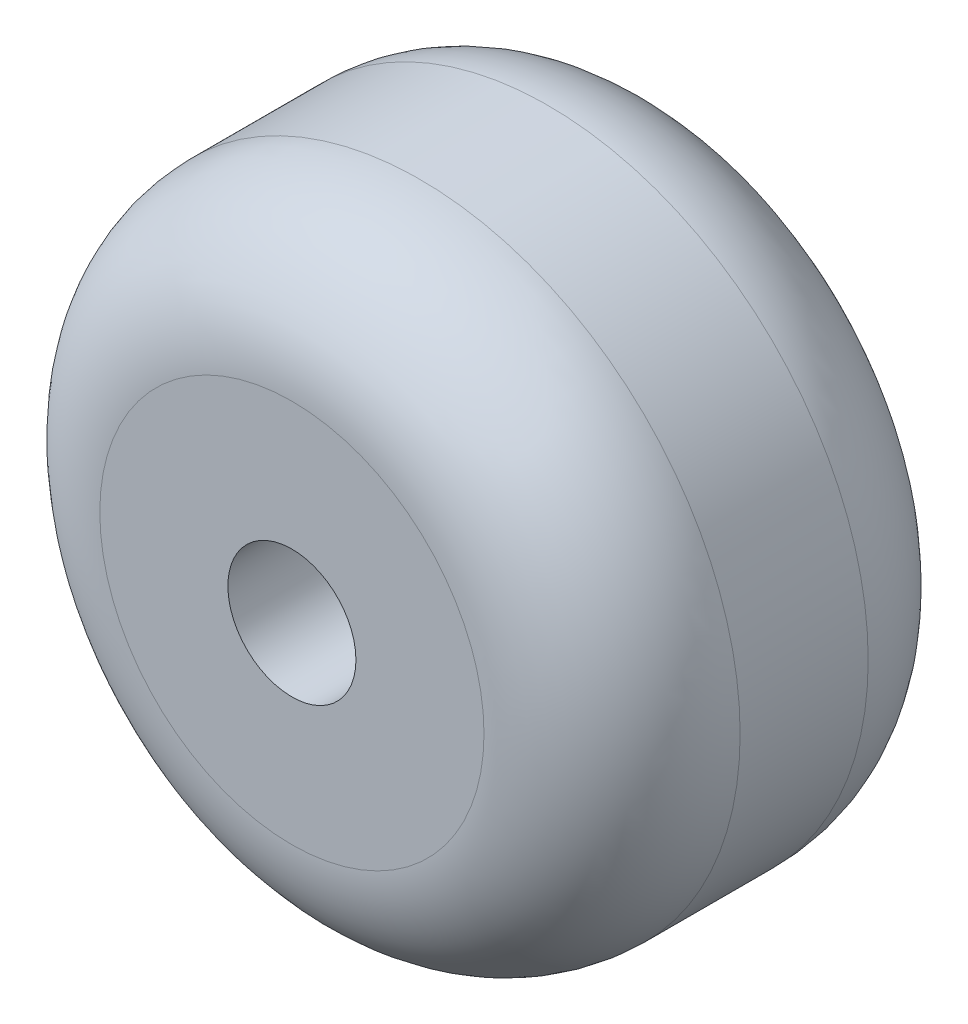
from build123d import *

# Parameters (mm, degrees)
SKETCH1_R           = 25
SKETCH1_R_2         = 5
BOSS_EXTRUDE1_DEPTH = 30
FILLET1_R           = 10


with BuildPart() as part:
    # Sketch1 → Boss-Extrude1 (new body)
    with BuildSketch(Plane.XY):
        Circle(SKETCH1_R)
        Circle(SKETCH1_R_2, mode=Mode.SUBTRACT)
    extrude(amount=BOSS_EXTRUDE1_DEPTH)

    # Fillet1
    fillet1_edges = [part.edges().sort_by_distance(p)[0] for p in [
        (-25, 0, 0),
        (-25, 0, 30),
    ]]
    fillet(fillet1_edges, radius=FILLET1_R)


solid = part.part
